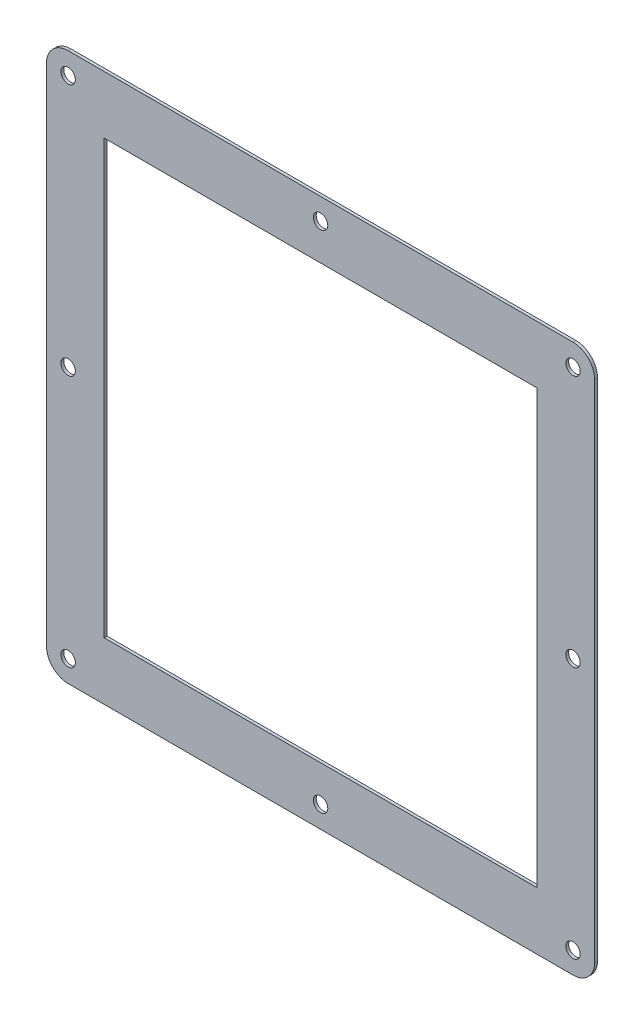
from build123d import *

# Parameters (mm, degrees)
SKETCH2_R           = 5
SKETCH2_W           = 300
SKETCH2_H           = 300
BOSS_EXTRUDE1_DEPTH = 2


with BuildPart() as part:
    # Sketch2 → Boss-Extrude1 (new body)
    with BuildSketch(Plane.XY):
        with BuildLine():
            Line((-175, 190), (175, 190))
            ThreePointArc((175, 190), (185.606601718, 185.606601718), (190, 175))
            Line((190, 175), (190, -175))
            ThreePointArc((190, -175), (185.606601718, -185.606601718), (175, -190))
            Line((175, -190), (-175, -190))
            ThreePointArc((-175, -190), (-185.606601718, -185.606601718), (-190, -175))
            Line((-190, -175), (-190, 175))
            ThreePointArc((-190, 175), (-185.606601718, 185.606601718), (-175, 190))
        make_face()
        with Locations((-175, 175)):
            Circle(SKETCH2_R, mode=Mode.SUBTRACT)
        with Locations((0, 175)):
            Circle(SKETCH2_R, mode=Mode.SUBTRACT)
        with Locations((175, 175)):
            Circle(SKETCH2_R, mode=Mode.SUBTRACT)
        with Locations((175, 0)):
            Circle(SKETCH2_R, mode=Mode.SUBTRACT)
        with Locations((-175, 0)):
            Circle(SKETCH2_R, mode=Mode.SUBTRACT)
        with Locations((-175, -175)):
            Circle(SKETCH2_R, mode=Mode.SUBTRACT)
        with Locations((0, -175)):
            Circle(SKETCH2_R, mode=Mode.SUBTRACT)
        with Locations((175, -175)):
            Circle(SKETCH2_R, mode=Mode.SUBTRACT)
        Rectangle(SKETCH2_W, SKETCH2_H, mode=Mode.SUBTRACT)
    extrude(amount=BOSS_EXTRUDE1_DEPTH)


solid = part.part
